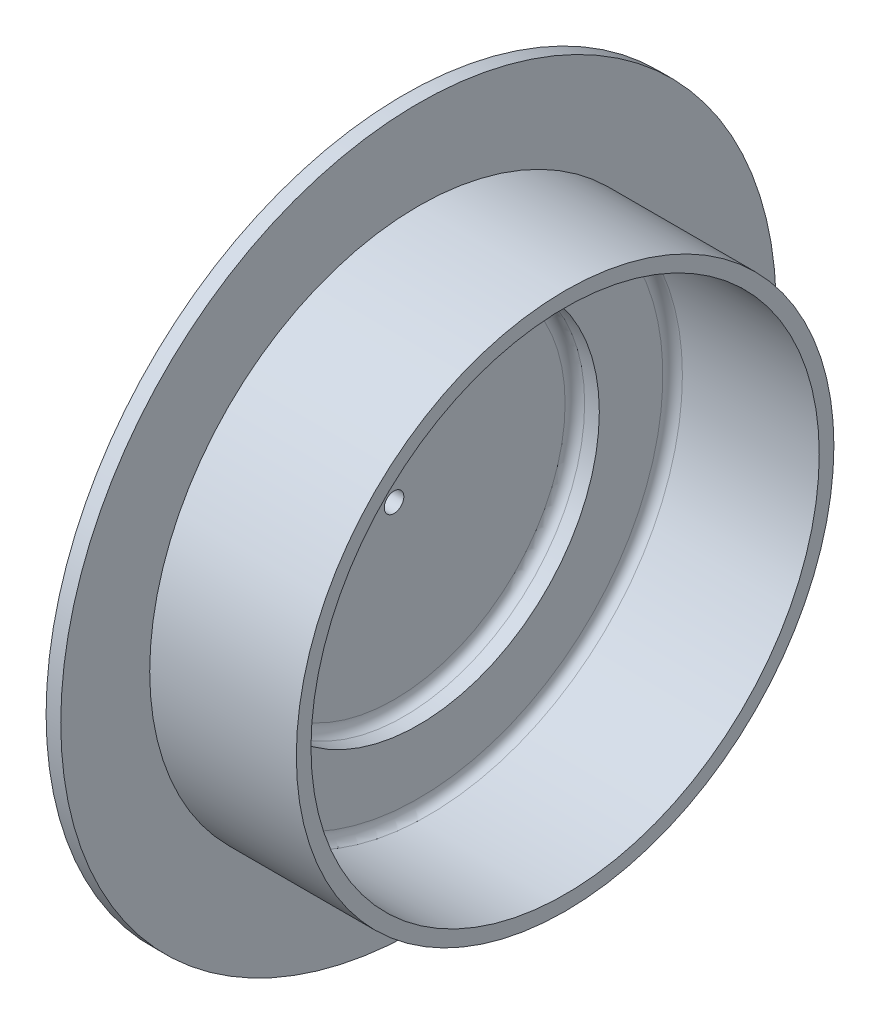
from build123d import *


with BuildPart() as part:
    # Sketch1 → Revolve1 (revolve)
    with BuildSketch(Plane.XY, mode=Mode.PRIVATE) as revolve1_sk:
        with BuildLine():
            Line((0, 40), (0, 37))
            Line((0, 37), (8, 37))
            ThreePointArc((8, 37), (9.414213562, 36.414213562), (10, 35))
            Line((10, 35), (10, 2))
            Line((10, 2), (13, 2))
            Line((13, 2), (13, 35))
            ThreePointArc((13, 35), (13.585786438, 36.414213562), (15, 37))
            Line((15, 37), (18, 37))
            Line((18, 37), (18, 50))
            ThreePointArc((18, 50), (18.585786438, 51.414213562), (20, 52))
            Line((20, 52), (48, 52))
            Line((48, 52), (48, 55))
            Line((48, 55), (18, 55))
            Line((18, 55), (18, 73.2))
            Line((18, 73.2), (15, 73.2))
            Line((15, 73.2), (15, 52))
            Line((15, 52), (15, 40))
            Line((15, 40), (0, 40))
        make_face()
    revolve(revolve1_sk.sketch.rotate(Axis((0, 0, 0), (1, 0, 0)), 90), axis=Axis((0, 0, 0), (1, 0, 0)))


solid = part.part
